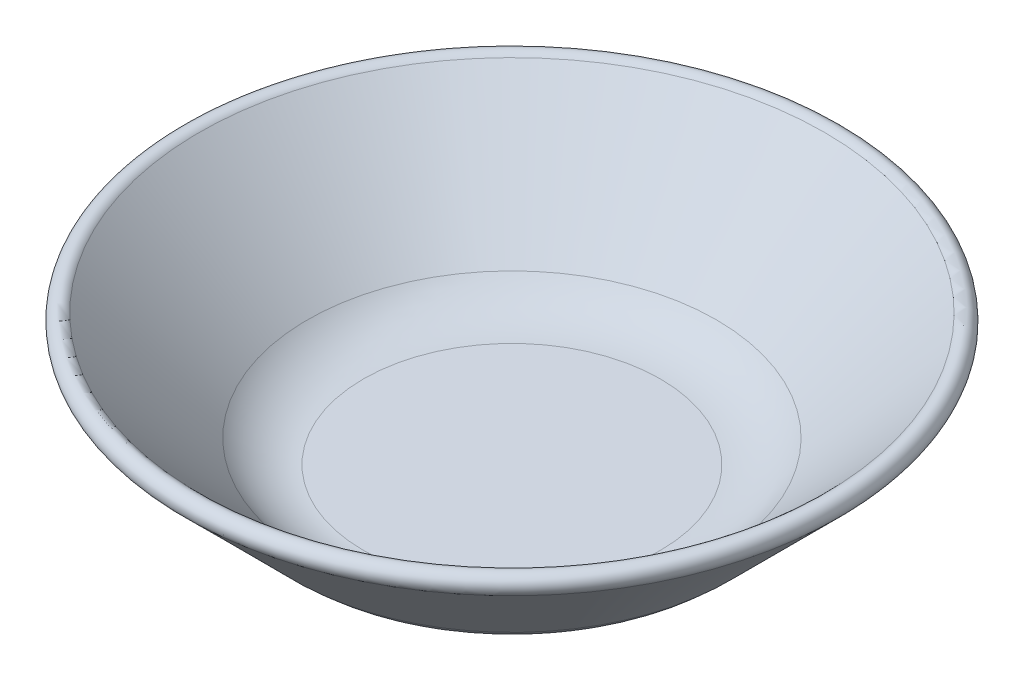
from build123d import *


with BuildPart() as part:
    # Sketch1 → Revolve1 (revolve)
    with BuildSketch(Plane.XY, mode=Mode.PRIVATE) as revolve1_sk:
        with BuildLine():
            Line((0, 0), (37.5, 0))
            ThreePointArc((37.5, 0), (47.067085809, 1.903011687), (55.17766953, 7.32233047))
            Line((55.17766953, 7.32233047), (82.5, 34.644660941))
            ThreePointArc((82.5, 34.644660941), (82.5, 38.180194847), (78.964466094, 38.180194847))
            Line((78.964466094, 38.180194847), (51.642135624, 10.857864376))
            ThreePointArc((51.642135624, 10.857864376), (45.153668647, 6.52240935), (37.5, 5))
            Line((37.5, 5), (0, 5))
            Line((0, 5), (0, 0))
        make_face()
    revolve(revolve1_sk.sketch.rotate(Axis((0, 0, 0), (0, 1, 0)), 90), axis=Axis((0, 0, 0), (0, 1, 0)))


solid = part.part
